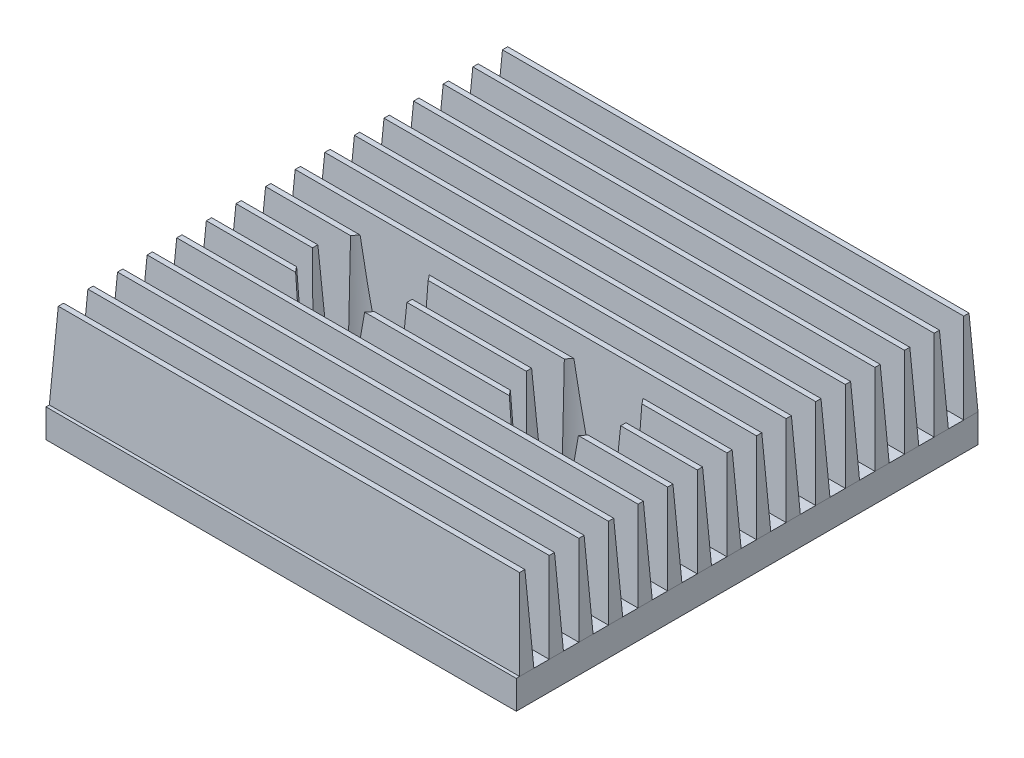
from build123d import *

# Parameters (mm, degrees)
SKETCH1_W                      = 41.91
SKETCH1_H                      = 48.768
SKETCH1_R                      = 1.5
BOSS_EXTRUDE1_DEPTH            = 2.54
SKETCH2_W                      = 41.91
SKETCH2_H                      = 1.27
BOSS_EXTRUDE2_DEPTH            = 7.62
BOSS_EXTRUDE2_DRAFT            = 3
BOSS_EXTRUDE2_PROFILE_2_DEPTH  = 7.62
BOSS_EXTRUDE2_PROFILE_2_DRAFT  = 3
BOSS_EXTRUDE2_PROFILE_3_DEPTH  = 7.62
BOSS_EXTRUDE2_PROFILE_3_DRAFT  = 3
BOSS_EXTRUDE2_PROFILE_4_DEPTH  = 7.62
BOSS_EXTRUDE2_PROFILE_4_DRAFT  = 3
BOSS_EXTRUDE2_PROFILE_5_DEPTH  = 7.62
BOSS_EXTRUDE2_PROFILE_5_DRAFT  = 3
BOSS_EXTRUDE2_PROFILE_6_DEPTH  = 7.62
BOSS_EXTRUDE2_PROFILE_6_DRAFT  = 3
BOSS_EXTRUDE2_PROFILE_7_DEPTH  = 7.62
BOSS_EXTRUDE2_PROFILE_7_DRAFT  = 3
BOSS_EXTRUDE2_PROFILE_8_DEPTH  = 7.62
BOSS_EXTRUDE2_PROFILE_8_DRAFT  = 3
BOSS_EXTRUDE2_PROFILE_9_DEPTH  = 7.62
BOSS_EXTRUDE2_PROFILE_9_DRAFT  = 3
BOSS_EXTRUDE2_PROFILE_10_DEPTH = 7.62
BOSS_EXTRUDE2_PROFILE_10_DRAFT = 3
BOSS_EXTRUDE2_PROFILE_11_DEPTH = 7.62
BOSS_EXTRUDE2_PROFILE_11_DRAFT = 3
BOSS_EXTRUDE2_PROFILE_12_DEPTH = 7.62
BOSS_EXTRUDE2_PROFILE_12_DRAFT = 3
BOSS_EXTRUDE2_PROFILE_13_DEPTH = 7.62
BOSS_EXTRUDE2_PROFILE_13_DRAFT = 3
BOSS_EXTRUDE2_PROFILE_14_DEPTH = 7.62
BOSS_EXTRUDE2_PROFILE_14_DRAFT = 3
BOSS_EXTRUDE2_PROFILE_15_DEPTH = 7.62
BOSS_EXTRUDE2_PROFILE_15_DRAFT = 3
BOSS_EXTRUDE2_PROFILE_16_DEPTH = 7.62
BOSS_EXTRUDE2_PROFILE_16_DRAFT = 3
BOSS_EXTRUDE2_PROFILE_17_DEPTH = 7.62
BOSS_EXTRUDE2_PROFILE_17_DRAFT = 3
BOSS_EXTRUDE2_PROFILE_18_DEPTH = 7.62
BOSS_EXTRUDE2_PROFILE_18_DRAFT = 3
BOSS_EXTRUDE2_PROFILE_19_DEPTH = 7.62
BOSS_EXTRUDE2_PROFILE_19_DRAFT = 3
BOSS_EXTRUDE2_PROFILE_20_DEPTH = 7.62
BOSS_EXTRUDE2_PROFILE_20_DRAFT = 3
BOSS_EXTRUDE2_PROFILE_21_DEPTH = 7.62
BOSS_EXTRUDE2_PROFILE_21_DRAFT = 3
BOSS_EXTRUDE2_PROFILE_22_DEPTH = 7.62
BOSS_EXTRUDE2_PROFILE_22_DRAFT = 3
CUT_EXTRUDE1_DEPTH             = 34.041729389
CUT_EXTRUDE1_DEPTH_BACK        = 34.041729389
SKETCH3_W                      = 41.91
SKETCH3_H                      = 7.62


with BuildPart() as part:
    # Sketch1 → Boss-Extrude1 (new body)
    with BuildSketch(Plane(origin=(0, 0, 0), x_dir=(1, 0, 0), z_dir=(0, 1, 0))):
        Rectangle(SKETCH1_W, SKETCH1_H)
        with Locations(Location((-9.525, 0, 0), (0, 0, 270))):
            Circle(SKETCH1_R, mode=Mode.SUBTRACT)
        with Locations(Location((9.525, 0, 0), (0, 0, 270))):
            Circle(SKETCH1_R, mode=Mode.SUBTRACT)
    extrude(amount=BOSS_EXTRUDE1_DEPTH)


with BuildPart() as boss_extrude2_tool:
    # Sketch2 → Boss-Extrude2 (with draft: the straight prism first)
    with BuildSketch(Plane(origin=(0, 2.54, 0), x_dir=(1, 0, 0), z_dir=(0, 1, 0))):
        with Locations((0, 23.749)):
            Rectangle(SKETCH2_W, SKETCH2_H)
    extrude(amount=BOSS_EXTRUDE2_DEPTH)
    # Boss-Extrude2: the draft: its side faces are tilted about the plane it starts from
    boss_extrude2_sides = [boss_extrude2_tool.faces().sort_by_distance(p)[0] for p in [
        (0, 6.35, -24.384),
        (-20.955, 6.35, -23.749),
        (0, 6.35, -23.114),
        (20.955, 6.35, -23.749),
    ]]
    draft(boss_extrude2_sides, Plane(origin=(0, 2.54, 0), x_dir=(1, 0, 0), z_dir=(0, 1, 0)), BOSS_EXTRUDE2_DRAFT)


with BuildPart() as part_1:
    add(part.part)

    # Boss-Extrude2: add boss_extrude2_tool
    add(boss_extrude2_tool.part)


with BuildPart() as boss_extrude2_profile_2_tool:
    # Sketch2 → Boss-Extrude2 profile 2 (with draft: the straight prism first)
    with BuildSketch(Plane(origin=(0, 2.54, 0), x_dir=(1, 0, 0), z_dir=(0, 1, 0))):
        with Locations((0, 21.110222222)):
            Rectangle(SKETCH2_W, SKETCH2_H)
    extrude(amount=BOSS_EXTRUDE2_PROFILE_2_DEPTH)
    # Boss-Extrude2 profile 2: the draft: its side faces are tilted about the plane it starts from
    boss_extrude2_profile_2_sides = [boss_extrude2_profile_2_tool.faces().sort_by_distance(p)[0] for p in [
        (0, 6.35, -20.475222222),
        (20.955, 6.35, -21.110222222),
        (0, 6.35, -21.745222222),
        (-20.955, 6.35, -21.110222222),
    ]]
    draft(boss_extrude2_profile_2_sides, Plane(origin=(0, 2.54, 0), x_dir=(1, 0, 0), z_dir=(0, 1, 0)), BOSS_EXTRUDE2_PROFILE_2_DRAFT)


with BuildPart() as part_2:
    add(part_1.part)

    # Boss-Extrude2 profile 2: add boss_extrude2_profile_2_tool
    add(boss_extrude2_profile_2_tool.part)


with BuildPart() as boss_extrude2_profile_3_tool:
    # Sketch2 → Boss-Extrude2 profile 3 (with draft: the straight prism first)
    with BuildSketch(Plane(origin=(0, 2.54, 0), x_dir=(1, 0, 0), z_dir=(0, 1, 0))):
        with Locations((0, 18.471444444)):
            Rectangle(SKETCH2_W, SKETCH2_H)
    extrude(amount=BOSS_EXTRUDE2_PROFILE_3_DEPTH)
    # Boss-Extrude2 profile 3: the draft: its side faces are tilted about the plane it starts from
    boss_extrude2_profile_3_sides = [boss_extrude2_profile_3_tool.faces().sort_by_distance(p)[0] for p in [
        (0, 6.35, -17.836444444),
        (20.955, 6.35, -18.471444444),
        (0, 6.35, -19.106444444),
        (-20.955, 6.35, -18.471444444),
    ]]
    draft(boss_extrude2_profile_3_sides, Plane(origin=(0, 2.54, 0), x_dir=(1, 0, 0), z_dir=(0, 1, 0)), BOSS_EXTRUDE2_PROFILE_3_DRAFT)


with BuildPart() as part_3:
    add(part_2.part)

    # Boss-Extrude2 profile 3: add boss_extrude2_profile_3_tool
    add(boss_extrude2_profile_3_tool.part)


with BuildPart() as boss_extrude2_profile_4_tool:
    # Sketch2 → Boss-Extrude2 profile 4 (with draft: the straight prism first)
    with BuildSketch(Plane(origin=(0, 2.54, 0), x_dir=(1, 0, 0), z_dir=(0, 1, 0))):
        with Locations((0, 15.832666667)):
            Rectangle(SKETCH2_W, SKETCH2_H)
    extrude(amount=BOSS_EXTRUDE2_PROFILE_4_DEPTH)
    # Boss-Extrude2 profile 4: the draft: its side faces are tilted about the plane it starts from
    boss_extrude2_profile_4_sides = [boss_extrude2_profile_4_tool.faces().sort_by_distance(p)[0] for p in [
        (0, 6.35, -15.197666667),
        (20.955, 6.35, -15.832666667),
        (0, 6.35, -16.467666667),
        (-20.955, 6.35, -15.832666667),
    ]]
    draft(boss_extrude2_profile_4_sides, Plane(origin=(0, 2.54, 0), x_dir=(1, 0, 0), z_dir=(0, 1, 0)), BOSS_EXTRUDE2_PROFILE_4_DRAFT)


with BuildPart() as part_4:
    add(part_3.part)

    # Boss-Extrude2 profile 4: add boss_extrude2_profile_4_tool
    add(boss_extrude2_profile_4_tool.part)


with BuildPart() as boss_extrude2_profile_5_tool:
    # Sketch2 → Boss-Extrude2 profile 5 (with draft: the straight prism first)
    with BuildSketch(Plane(origin=(0, 2.54, 0), x_dir=(1, 0, 0), z_dir=(0, 1, 0))):
        with Locations((0, 13.193888889)):
            Rectangle(SKETCH2_W, SKETCH2_H)
    extrude(amount=BOSS_EXTRUDE2_PROFILE_5_DEPTH)
    # Boss-Extrude2 profile 5: the draft: its side faces are tilted about the plane it starts from
    boss_extrude2_profile_5_sides = [boss_extrude2_profile_5_tool.faces().sort_by_distance(p)[0] for p in [
        (0, 6.35, -12.558888889),
        (20.955, 6.35, -13.193888889),
        (0, 6.35, -13.828888889),
        (-20.955, 6.35, -13.193888889),
    ]]
    draft(boss_extrude2_profile_5_sides, Plane(origin=(0, 2.54, 0), x_dir=(1, 0, 0), z_dir=(0, 1, 0)), BOSS_EXTRUDE2_PROFILE_5_DRAFT)


with BuildPart() as part_5:
    add(part_4.part)

    # Boss-Extrude2 profile 5: add boss_extrude2_profile_5_tool
    add(boss_extrude2_profile_5_tool.part)


with BuildPart() as boss_extrude2_profile_6_tool:
    # Sketch2 → Boss-Extrude2 profile 6 (with draft: the straight prism first)
    with BuildSketch(Plane(origin=(0, 2.54, 0), x_dir=(1, 0, 0), z_dir=(0, 1, 0))):
        with Locations((0, 10.555111111)):
            Rectangle(SKETCH2_W, SKETCH2_H)
    extrude(amount=BOSS_EXTRUDE2_PROFILE_6_DEPTH)
    # Boss-Extrude2 profile 6: the draft: its side faces are tilted about the plane it starts from
    boss_extrude2_profile_6_sides = [boss_extrude2_profile_6_tool.faces().sort_by_distance(p)[0] for p in [
        (0, 6.35, -9.920111111),
        (20.955, 6.35, -10.555111111),
        (0, 6.35, -11.190111111),
        (-20.955, 6.35, -10.555111111),
    ]]
    draft(boss_extrude2_profile_6_sides, Plane(origin=(0, 2.54, 0), x_dir=(1, 0, 0), z_dir=(0, 1, 0)), BOSS_EXTRUDE2_PROFILE_6_DRAFT)


with BuildPart() as part_6:
    add(part_5.part)

    # Boss-Extrude2 profile 6: add boss_extrude2_profile_6_tool
    add(boss_extrude2_profile_6_tool.part)


with BuildPart() as boss_extrude2_profile_7_tool:
    # Sketch2 → Boss-Extrude2 profile 7 (with draft: the straight prism first)
    with BuildSketch(Plane(origin=(0, 2.54, 0), x_dir=(1, 0, 0), z_dir=(0, 1, 0))):
        with Locations((0, 7.916333333)):
            Rectangle(SKETCH2_W, SKETCH2_H)
    extrude(amount=BOSS_EXTRUDE2_PROFILE_7_DEPTH)
    # Boss-Extrude2 profile 7: the draft: its side faces are tilted about the plane it starts from
    boss_extrude2_profile_7_sides = [boss_extrude2_profile_7_tool.faces().sort_by_distance(p)[0] for p in [
        (0, 6.35, -7.281333333),
        (20.955, 6.35, -7.916333333),
        (0, 6.35, -8.551333333),
        (-20.955, 6.35, -7.916333333),
    ]]
    draft(boss_extrude2_profile_7_sides, Plane(origin=(0, 2.54, 0), x_dir=(1, 0, 0), z_dir=(0, 1, 0)), BOSS_EXTRUDE2_PROFILE_7_DRAFT)


with BuildPart() as part_7:
    add(part_6.part)

    # Boss-Extrude2 profile 7: add boss_extrude2_profile_7_tool
    add(boss_extrude2_profile_7_tool.part)


with BuildPart() as boss_extrude2_profile_8_tool:
    # Sketch2 → Boss-Extrude2 profile 8 (with draft: the straight prism first)
    with BuildSketch(Plane(origin=(0, 2.54, 0), x_dir=(1, 0, 0), z_dir=(0, 1, 0))):
        with Locations((0, 5.277555556)):
            Rectangle(SKETCH2_W, SKETCH2_H)
    extrude(amount=BOSS_EXTRUDE2_PROFILE_8_DEPTH)
    # Boss-Extrude2 profile 8: the draft: its side faces are tilted about the plane it starts from
    boss_extrude2_profile_8_sides = [boss_extrude2_profile_8_tool.faces().sort_by_distance(p)[0] for p in [
        (0, 6.35, -4.642555556),
        (20.955, 6.35, -5.277555556),
        (0, 6.35, -5.912555556),
        (-20.955, 6.35, -5.277555556),
    ]]
    draft(boss_extrude2_profile_8_sides, Plane(origin=(0, 2.54, 0), x_dir=(1, 0, 0), z_dir=(0, 1, 0)), BOSS_EXTRUDE2_PROFILE_8_DRAFT)


with BuildPart() as part_8:
    add(part_7.part)

    # Boss-Extrude2 profile 8: add boss_extrude2_profile_8_tool
    add(boss_extrude2_profile_8_tool.part)


with BuildPart() as boss_extrude2_profile_9_tool:
    # Sketch2 → Boss-Extrude2 profile 9 (with draft: the straight prism first)
    with BuildSketch(Plane(origin=(0, 2.54, 0), x_dir=(1, 0, 0), z_dir=(0, 1, 0))):
        with BuildLine():
            Line((12.765520732, 2.003777778), (20.955, 2.003777778))
            Line((20.955, 2.003777778), (20.955, 3.273777778))
            Line((20.955, 3.273777778), (11.473968717, 3.273777778))
            ThreePointArc((11.473968717, 3.273777778), (12.196315254, 2.716647716), (12.765520732, 2.003777778))
        make_face()
    extrude(amount=BOSS_EXTRUDE2_PROFILE_9_DEPTH)
    # Boss-Extrude2 profile 9: the draft: its side faces are tilted about the plane it starts from
    boss_extrude2_profile_9_sides = [boss_extrude2_profile_9_tool.faces().sort_by_distance(p)[0] for p in [
        (16.860260366, 6.35, -2.003777778),
        (20.955, 6.35, -2.638777778),
        (16.214484359, 6.35, -3.273777778),
        (12.196315254, 6.35, -2.716647716),
    ]]
    draft(boss_extrude2_profile_9_sides, Plane(origin=(0, 2.54, 0), x_dir=(1, 0, 0), z_dir=(0, 1, 0)), BOSS_EXTRUDE2_PROFILE_9_DRAFT)


with BuildPart() as part_9:
    add(part_8.part)

    # Boss-Extrude2 profile 9: add boss_extrude2_profile_9_tool
    add(boss_extrude2_profile_9_tool.part)


with BuildPart() as boss_extrude2_profile_10_tool:
    # Sketch2 → Boss-Extrude2 profile 10 (with draft: the straight prism first)
    with BuildSketch(Plane(origin=(0, 2.54, 0), x_dir=(1, 0, 0), z_dir=(0, 1, 0))):
        with BuildLine():
            Line((-6.284479268, 2.003777778), (6.284479268, 2.003777778))
            ThreePointArc((6.284479268, 2.003777778), (6.853684746, 2.716647716), (7.576031283, 3.273777778))
            Line((7.576031283, 3.273777778), (-7.576031283, 3.273777778))
            ThreePointArc((-7.576031283, 3.273777778), (-6.853684746, 2.716647716), (-6.284479268, 2.003777778))
        make_face()
    extrude(amount=BOSS_EXTRUDE2_PROFILE_10_DEPTH)
    # Boss-Extrude2 profile 10: the draft: its side faces are tilted about the plane it starts from
    boss_extrude2_profile_10_sides = [boss_extrude2_profile_10_tool.faces().sort_by_distance(p)[0] for p in [
        (0, 6.35, -2.003777778),
        (6.853684746, 6.35, -2.716647716),
        (0, 6.35, -3.273777778),
        (-6.853684746, 6.35, -2.716647716),
    ]]
    draft(boss_extrude2_profile_10_sides, Plane(origin=(0, 2.54, 0), x_dir=(1, 0, 0), z_dir=(0, 1, 0)), BOSS_EXTRUDE2_PROFILE_10_DRAFT)


with BuildPart() as part_10:
    add(part_9.part)

    # Boss-Extrude2 profile 10: add boss_extrude2_profile_10_tool
    add(boss_extrude2_profile_10_tool.part)


with BuildPart() as boss_extrude2_profile_11_tool:
    # Sketch2 → Boss-Extrude2 profile 11 (with draft: the straight prism first)
    with BuildSketch(Plane(origin=(0, 2.54, 0), x_dir=(1, 0, 0), z_dir=(0, 1, 0))):
        with BuildLine():
            Line((20.955, 0.635), (13.281710662, 0.635))
            ThreePointArc((13.281710662, 0.635), (13.335, 0), (13.281710662, -0.635))
            Line((13.281710662, -0.635), (20.955, -0.635))
            Line((20.955, -0.635), (20.955, 0.635))
        make_face()
    extrude(amount=BOSS_EXTRUDE2_PROFILE_11_DEPTH)
    # Boss-Extrude2 profile 11: the draft: its side faces are tilted about the plane it starts from
    boss_extrude2_profile_11_sides = [boss_extrude2_profile_11_tool.faces().sort_by_distance(p)[0] for p in [
        (17.118355331, 6.35, 0.635),
        (20.955, 6.35, 0),
        (17.118355331, 6.35, -0.635),
        (13.335, 6.35, 0),
    ]]
    draft(boss_extrude2_profile_11_sides, Plane(origin=(0, 2.54, 0), x_dir=(1, 0, 0), z_dir=(0, 1, 0)), BOSS_EXTRUDE2_PROFILE_11_DRAFT)


with BuildPart() as part_11:
    add(part_10.part)

    # Boss-Extrude2 profile 11: add boss_extrude2_profile_11_tool
    add(boss_extrude2_profile_11_tool.part)


with BuildPart() as boss_extrude2_profile_12_tool:
    # Sketch2 → Boss-Extrude2 profile 12 (with draft: the straight prism first)
    with BuildSketch(Plane(origin=(0, 2.54, 0), x_dir=(1, 0, 0), z_dir=(0, 1, 0))):
        with BuildLine():
            ThreePointArc((5.768289338, -0.635), (5.715, 0), (5.768289338, 0.635))
            Line((5.768289338, 0.635), (-5.768289338, 0.635))
            ThreePointArc((-5.768289338, 0.635), (-5.715, 0), (-5.768289338, -0.635))
            Line((-5.768289338, -0.635), (5.768289338, -0.635))
        make_face()
    extrude(amount=BOSS_EXTRUDE2_PROFILE_12_DEPTH)
    # Boss-Extrude2 profile 12: the draft: its side faces are tilted about the plane it starts from
    boss_extrude2_profile_12_sides = [boss_extrude2_profile_12_tool.faces().sort_by_distance(p)[0] for p in [
        (0, 6.35, -0.635),
        (-5.715, 6.35, 0),
        (0, 6.35, 0.635),
        (5.715, 6.35, 0),
    ]]
    draft(boss_extrude2_profile_12_sides, Plane(origin=(0, 2.54, 0), x_dir=(1, 0, 0), z_dir=(0, 1, 0)), BOSS_EXTRUDE2_PROFILE_12_DRAFT)


with BuildPart() as part_12:
    add(part_11.part)

    # Boss-Extrude2 profile 12: add boss_extrude2_profile_12_tool
    add(boss_extrude2_profile_12_tool.part)


with BuildPart() as boss_extrude2_profile_13_tool:
    # Sketch2 → Boss-Extrude2 profile 13 (with draft: the straight prism first)
    with BuildSketch(Plane(origin=(0, 2.54, 0), x_dir=(1, 0, 0), z_dir=(0, 1, 0))):
        with BuildLine():
            Line((-20.955, 2.003777778), (-12.765520732, 2.003777778))
            ThreePointArc((-12.765520732, 2.003777778), (-12.196315254, 2.716647716), (-11.473968717, 3.273777778))
            Line((-11.473968717, 3.273777778), (-20.955, 3.273777778))
            Line((-20.955, 3.273777778), (-20.955, 2.003777778))
        make_face()
    extrude(amount=BOSS_EXTRUDE2_PROFILE_13_DEPTH)
    # Boss-Extrude2 profile 13: the draft: its side faces are tilted about the plane it starts from
    boss_extrude2_profile_13_sides = [boss_extrude2_profile_13_tool.faces().sort_by_distance(p)[0] for p in [
        (-16.214484359, 6.35, -3.273777778),
        (-20.955, 6.35, -2.638777778),
        (-16.860260366, 6.35, -2.003777778),
        (-12.196315254, 6.35, -2.716647716),
    ]]
    draft(boss_extrude2_profile_13_sides, Plane(origin=(0, 2.54, 0), x_dir=(1, 0, 0), z_dir=(0, 1, 0)), BOSS_EXTRUDE2_PROFILE_13_DRAFT)


with BuildPart() as part_13:
    add(part_12.part)

    # Boss-Extrude2 profile 13: add boss_extrude2_profile_13_tool
    add(boss_extrude2_profile_13_tool.part)


with BuildPart() as boss_extrude2_profile_14_tool:
    # Sketch2 → Boss-Extrude2 profile 14 (with draft: the straight prism first)
    with BuildSketch(Plane(origin=(0, 2.54, 0), x_dir=(1, 0, 0), z_dir=(0, 1, 0))):
        with BuildLine():
            ThreePointArc((-13.281710662, -0.635), (-13.335, 0), (-13.281710662, 0.635))
            Line((-13.281710662, 0.635), (-20.955, 0.635))
            Line((-20.955, 0.635), (-20.955, -0.635))
            Line((-20.955, -0.635), (-13.281710662, -0.635))
        make_face()
    extrude(amount=BOSS_EXTRUDE2_PROFILE_14_DEPTH)
    # Boss-Extrude2 profile 14: the draft: its side faces are tilted about the plane it starts from
    boss_extrude2_profile_14_sides = [boss_extrude2_profile_14_tool.faces().sort_by_distance(p)[0] for p in [
        (-17.118355331, 6.35, -0.635),
        (-20.955, 6.35, 0),
        (-17.118355331, 6.35, 0.635),
        (-13.335, 6.35, 0),
    ]]
    draft(boss_extrude2_profile_14_sides, Plane(origin=(0, 2.54, 0), x_dir=(1, 0, 0), z_dir=(0, 1, 0)), BOSS_EXTRUDE2_PROFILE_14_DRAFT)


with BuildPart() as part_14:
    add(part_13.part)

    # Boss-Extrude2 profile 14: add boss_extrude2_profile_14_tool
    add(boss_extrude2_profile_14_tool.part)


with BuildPart() as boss_extrude2_profile_15_tool:
    # Sketch2 → Boss-Extrude2 profile 15 (with draft: the straight prism first)
    with BuildSketch(Plane(origin=(0, 2.54, 0), x_dir=(1, 0, 0), z_dir=(0, 1, 0))):
        with BuildLine():
            ThreePointArc((7.576031283, -3.273777778), (6.853684746, -2.716647716), (6.284479268, -2.003777778))
            Line((6.284479268, -2.003777778), (-6.284479268, -2.003777778))
            ThreePointArc((-6.284479268, -2.003777778), (-6.853684746, -2.716647716), (-7.576031283, -3.273777778))
            Line((-7.576031283, -3.273777778), (7.576031283, -3.273777778))
        make_face()
    extrude(amount=BOSS_EXTRUDE2_PROFILE_15_DEPTH)
    # Boss-Extrude2 profile 15: the draft: its side faces are tilted about the plane it starts from
    boss_extrude2_profile_15_sides = [boss_extrude2_profile_15_tool.faces().sort_by_distance(p)[0] for p in [
        (-6.853684746, 6.35, 2.716647716),
        (0, 6.35, 3.273777778),
        (6.853684746, 6.35, 2.716647716),
        (0, 6.35, 2.003777778),
    ]]
    draft(boss_extrude2_profile_15_sides, Plane(origin=(0, 2.54, 0), x_dir=(1, 0, 0), z_dir=(0, 1, 0)), BOSS_EXTRUDE2_PROFILE_15_DRAFT)


with BuildPart() as part_15:
    add(part_14.part)

    # Boss-Extrude2 profile 15: add boss_extrude2_profile_15_tool
    add(boss_extrude2_profile_15_tool.part)


with BuildPart() as boss_extrude2_profile_16_tool:
    # Sketch2 → Boss-Extrude2 profile 16 (with draft: the straight prism first)
    with BuildSketch(Plane(origin=(0, 2.54, 0), x_dir=(1, 0, 0), z_dir=(0, 1, 0))):
        with BuildLine():
            Line((20.955, -2.003777778), (12.765520732, -2.003777778))
            ThreePointArc((12.765520732, -2.003777778), (12.196315254, -2.716647716), (11.473968717, -3.273777778))
            Line((11.473968717, -3.273777778), (20.955, -3.273777778))
            Line((20.955, -3.273777778), (20.955, -2.003777778))
        make_face()
    extrude(amount=BOSS_EXTRUDE2_PROFILE_16_DEPTH)
    # Boss-Extrude2 profile 16: the draft: its side faces are tilted about the plane it starts from
    boss_extrude2_profile_16_sides = [boss_extrude2_profile_16_tool.faces().sort_by_distance(p)[0] for p in [
        (12.196315254, 6.35, 2.716647716),
        (16.214484359, 6.35, 3.273777778),
        (20.955, 6.35, 2.638777778),
        (16.860260366, 6.35, 2.003777778),
    ]]
    draft(boss_extrude2_profile_16_sides, Plane(origin=(0, 2.54, 0), x_dir=(1, 0, 0), z_dir=(0, 1, 0)), BOSS_EXTRUDE2_PROFILE_16_DRAFT)


with BuildPart() as part_16:
    add(part_15.part)

    # Boss-Extrude2 profile 16: add boss_extrude2_profile_16_tool
    add(boss_extrude2_profile_16_tool.part)


with BuildPart() as boss_extrude2_profile_17_tool:
    # Sketch2 → Boss-Extrude2 profile 17 (with draft: the straight prism first)
    with BuildSketch(Plane(origin=(0, 2.54, 0), x_dir=(1, 0, 0), z_dir=(0, 1, 0))):
        with BuildLine():
            ThreePointArc((-11.473968717, -3.273777778), (-12.196315254, -2.716647716), (-12.765520732, -2.003777778))
            Line((-12.765520732, -2.003777778), (-20.955, -2.003777778))
            Line((-20.955, -2.003777778), (-20.955, -3.273777778))
            Line((-20.955, -3.273777778), (-11.473968717, -3.273777778))
        make_face()
    extrude(amount=BOSS_EXTRUDE2_PROFILE_17_DEPTH)
    # Boss-Extrude2 profile 17: the draft: its side faces are tilted about the plane it starts from
    boss_extrude2_profile_17_sides = [boss_extrude2_profile_17_tool.faces().sort_by_distance(p)[0] for p in [
        (-12.196315254, 6.35, 2.716647716),
        (-16.860260366, 6.35, 2.003777778),
        (-20.955, 6.35, 2.638777778),
        (-16.214484359, 6.35, 3.273777778),
    ]]
    draft(boss_extrude2_profile_17_sides, Plane(origin=(0, 2.54, 0), x_dir=(1, 0, 0), z_dir=(0, 1, 0)), BOSS_EXTRUDE2_PROFILE_17_DRAFT)


with BuildPart() as part_17:
    add(part_16.part)

    # Boss-Extrude2 profile 17: add boss_extrude2_profile_17_tool
    add(boss_extrude2_profile_17_tool.part)


with BuildPart() as boss_extrude2_profile_18_tool:
    # Sketch2 → Boss-Extrude2 profile 18 (with draft: the straight prism first)
    with BuildSketch(Plane(origin=(0, 2.54, 0), x_dir=(1, 0, 0), z_dir=(0, 1, 0))):
        with Locations((0, -5.277555556)):
            Rectangle(SKETCH2_W, SKETCH2_H)
    extrude(amount=BOSS_EXTRUDE2_PROFILE_18_DEPTH)
    # Boss-Extrude2 profile 18: the draft: its side faces are tilted about the plane it starts from
    boss_extrude2_profile_18_sides = [boss_extrude2_profile_18_tool.faces().sort_by_distance(p)[0] for p in [
        (0, 6.35, 5.912555556),
        (20.955, 6.35, 5.277555556),
        (0, 6.35, 4.642555556),
        (-20.955, 6.35, 5.277555556),
    ]]
    draft(boss_extrude2_profile_18_sides, Plane(origin=(0, 2.54, 0), x_dir=(1, 0, 0), z_dir=(0, 1, 0)), BOSS_EXTRUDE2_PROFILE_18_DRAFT)


with BuildPart() as part_18:
    add(part_17.part)

    # Boss-Extrude2 profile 18: add boss_extrude2_profile_18_tool
    add(boss_extrude2_profile_18_tool.part)


with BuildPart() as boss_extrude2_profile_19_tool:
    # Sketch2 → Boss-Extrude2 profile 19 (with draft: the straight prism first)
    with BuildSketch(Plane(origin=(0, 2.54, 0), x_dir=(1, 0, 0), z_dir=(0, 1, 0))):
        with Locations((0, -7.916333333)):
            Rectangle(SKETCH2_W, SKETCH2_H)
    extrude(amount=BOSS_EXTRUDE2_PROFILE_19_DEPTH)
    # Boss-Extrude2 profile 19: the draft: its side faces are tilted about the plane it starts from
    boss_extrude2_profile_19_sides = [boss_extrude2_profile_19_tool.faces().sort_by_distance(p)[0] for p in [
        (0, 6.35, 8.551333333),
        (20.955, 6.35, 7.916333333),
        (0, 6.35, 7.281333333),
        (-20.955, 6.35, 7.916333333),
    ]]
    draft(boss_extrude2_profile_19_sides, Plane(origin=(0, 2.54, 0), x_dir=(1, 0, 0), z_dir=(0, 1, 0)), BOSS_EXTRUDE2_PROFILE_19_DRAFT)


with BuildPart() as part_19:
    add(part_18.part)

    # Boss-Extrude2 profile 19: add boss_extrude2_profile_19_tool
    add(boss_extrude2_profile_19_tool.part)


with BuildPart() as boss_extrude2_profile_20_tool:
    # Sketch2 → Boss-Extrude2 profile 20 (with draft: the straight prism first)
    with BuildSketch(Plane(origin=(0, 2.54, 0), x_dir=(1, 0, 0), z_dir=(0, 1, 0))):
        with Locations((0, -10.555111111)):
            Rectangle(SKETCH2_W, SKETCH2_H)
    extrude(amount=BOSS_EXTRUDE2_PROFILE_20_DEPTH)
    # Boss-Extrude2 profile 20: the draft: its side faces are tilted about the plane it starts from
    boss_extrude2_profile_20_sides = [boss_extrude2_profile_20_tool.faces().sort_by_distance(p)[0] for p in [
        (0, 6.35, 11.190111111),
        (20.955, 6.35, 10.555111111),
        (0, 6.35, 9.920111111),
        (-20.955, 6.35, 10.555111111),
    ]]
    draft(boss_extrude2_profile_20_sides, Plane(origin=(0, 2.54, 0), x_dir=(1, 0, 0), z_dir=(0, 1, 0)), BOSS_EXTRUDE2_PROFILE_20_DRAFT)


with BuildPart() as part_20:
    add(part_19.part)

    # Boss-Extrude2 profile 20: add boss_extrude2_profile_20_tool
    add(boss_extrude2_profile_20_tool.part)


with BuildPart() as boss_extrude2_profile_21_tool:
    # Sketch2 → Boss-Extrude2 profile 21 (with draft: the straight prism first)
    with BuildSketch(Plane(origin=(0, 2.54, 0), x_dir=(1, 0, 0), z_dir=(0, 1, 0))):
        with Locations((0, -13.193888889)):
            Rectangle(SKETCH2_W, SKETCH2_H)
    extrude(amount=BOSS_EXTRUDE2_PROFILE_21_DEPTH)
    # Boss-Extrude2 profile 21: the draft: its side faces are tilted about the plane it starts from
    boss_extrude2_profile_21_sides = [boss_extrude2_profile_21_tool.faces().sort_by_distance(p)[0] for p in [
        (0, 6.35, 13.828888889),
        (20.955, 6.35, 13.193888889),
        (0, 6.35, 12.558888889),
        (-20.955, 6.35, 13.193888889),
    ]]
    draft(boss_extrude2_profile_21_sides, Plane(origin=(0, 2.54, 0), x_dir=(1, 0, 0), z_dir=(0, 1, 0)), BOSS_EXTRUDE2_PROFILE_21_DRAFT)


with BuildPart() as part_21:
    add(part_20.part)

    # Boss-Extrude2 profile 21: add boss_extrude2_profile_21_tool
    add(boss_extrude2_profile_21_tool.part)


with BuildPart() as boss_extrude2_profile_22_tool:
    # Sketch2 → Boss-Extrude2 profile 22 (with draft: the straight prism first)
    with BuildSketch(Plane(origin=(0, 2.54, 0), x_dir=(1, 0, 0), z_dir=(0, 1, 0))):
        with Locations((0, -15.832666667)):
            Rectangle(SKETCH2_W, SKETCH2_H)
    extrude(amount=BOSS_EXTRUDE2_PROFILE_22_DEPTH)
    # Boss-Extrude2 profile 22: the draft: its side faces are tilted about the plane it starts from
    boss_extrude2_profile_22_sides = [boss_extrude2_profile_22_tool.faces().sort_by_distance(p)[0] for p in [
        (0, 6.35, 16.467666667),
        (20.955, 6.35, 15.832666667),
        (0, 6.35, 15.197666667),
        (-20.955, 6.35, 15.832666667),
    ]]
    draft(boss_extrude2_profile_22_sides, Plane(origin=(0, 2.54, 0), x_dir=(1, 0, 0), z_dir=(0, 1, 0)), BOSS_EXTRUDE2_PROFILE_22_DRAFT)


with BuildPart() as part_22:
    add(part_21.part)

    # Boss-Extrude2 profile 22: add boss_extrude2_profile_22_tool
    add(boss_extrude2_profile_22_tool.part)

    # Sketch3 → Cut-Extrude1 (cut, two sides: drawn at the far end of the back side and taken through both)
    with BuildSketch(Plane(origin=(0, 2.54, 0), x_dir=(1, 0, 0), z_dir=(0, 1, 0)).offset(-CUT_EXTRUDE1_DEPTH_BACK)):
        with Locations((0, -20.574)):
            Rectangle(SKETCH3_W, SKETCH3_H)
    extrude(amount=CUT_EXTRUDE1_DEPTH + CUT_EXTRUDE1_DEPTH_BACK, mode=Mode.SUBTRACT)


solid = part_22.part
